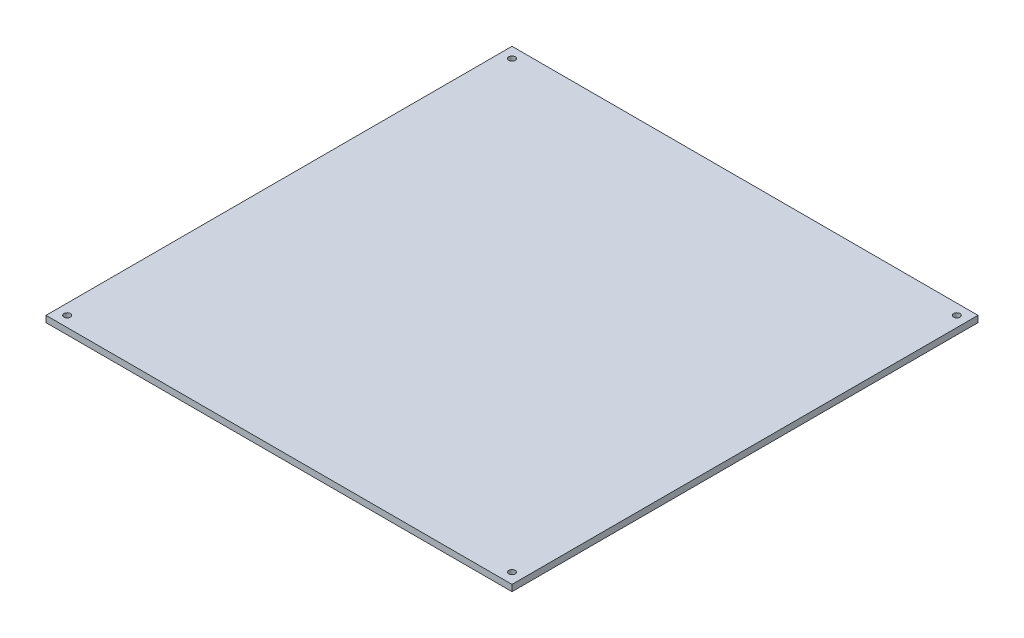
from build123d import *

# Parameters (mm, degrees)
SKETCH_1_W      = 220
SKETCH_1_H      = 220
SKETCH_1_R      = 1.5
EXTRUDE_1_DEPTH = 3


with BuildPart() as part:
    # 草图1 → 凸台-拉伸1 (new body)
    with BuildSketch(Plane(origin=(0, 0, 0), x_dir=(1, 0, 0), z_dir=(0, 1, 0))):
        with Locations((-110, -110)):
            Rectangle(SKETCH_1_W, SKETCH_1_H)
        with Locations(Location((-215, -5, 0), (0, 0, 270))):
            Circle(SKETCH_1_R, mode=Mode.SUBTRACT)
        with Locations(Location((-5, -5, 0), (0, 0, 270))):
            Circle(SKETCH_1_R, mode=Mode.SUBTRACT)
        with Locations(Location((-5, -215, 0), (0, 0, 270))):
            Circle(SKETCH_1_R, mode=Mode.SUBTRACT)
        with Locations(Location((-215, -215, 0), (0, 0, 270))):
            Circle(SKETCH_1_R, mode=Mode.SUBTRACT)
    extrude(amount=EXTRUDE_1_DEPTH)


solid = part.part
